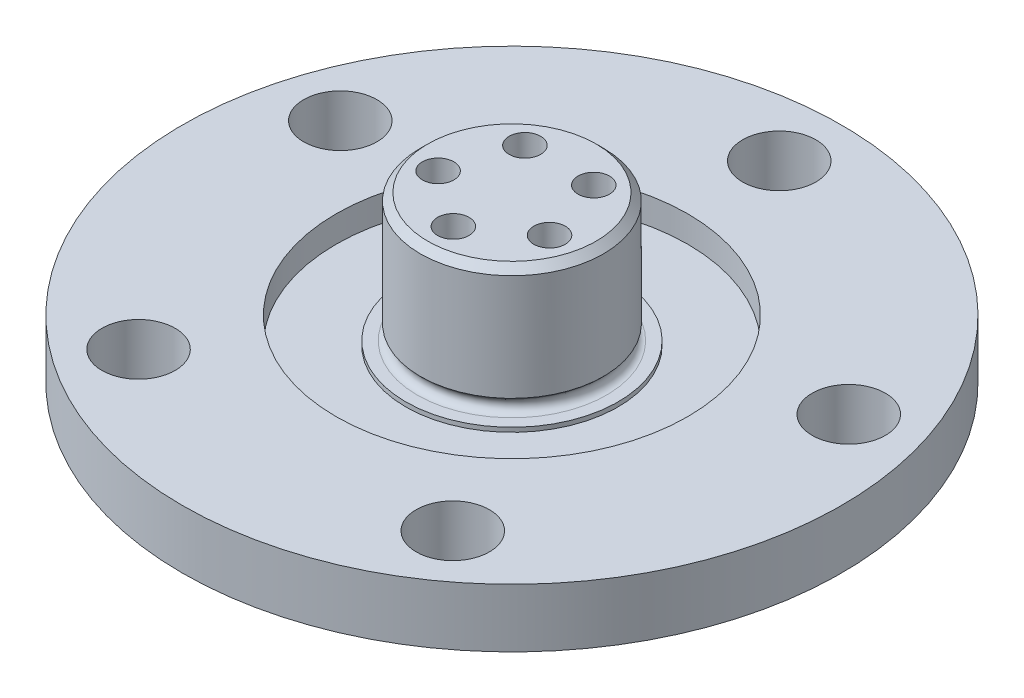
from build123d import *

# Parameters (mm, degrees)
SKETCH1_R                  = 45
SKETCH1_R_2                = 5
BOSS_EXTRUDE1_DEPTH        = 8
F_4_3_4_3_DIAMETER_HOLE1_D = 4.3
SKETCH6_R                  = 30.1
SKETCH6_R_2                = 19.9
CUT_EXTRUDE2_DEPTH         = 1.5
SKETCH8_R                  = 24
SKETCH8_R_2                = 12.5
CUT_EXTRUDE3_DEPTH         = 3
SKETCH9_R                  = 24
SKETCH9_R_2                = 14.5
CUT_EXTRUDE4_DEPTH         = 0.6
SKETCH10_R                 = 12.5
SKETCH10_R_2               = 2.15
BOSS_EXTRUDE2_DEPTH        = 14.5
CHAMFER1_SIZE              = 1
FILLET1_R                  = 1


with BuildPart() as part:
    # Sketch1 → Boss-Extrude1 (new body)
    with BuildSketch(Plane(origin=(0, 0, 0), x_dir=(1, 0, 0), z_dir=(0, 1, 0))):
        with Locations(Location((0, 0, 0), (0, 0, 270))):
            Circle(SKETCH1_R)
        with Locations(Location((0, 36.5, 0), (0, 0, 270))):
            Circle(SKETCH1_R_2, mode=Mode.SUBTRACT)
        with Locations(Location((34.713562845, 11.279120295, 0), (0, 0, 270))):
            Circle(SKETCH1_R_2, mode=Mode.SUBTRACT)
        with Locations(Location((21.454161709, -29.529120295, 0), (0, 0, 270))):
            Circle(SKETCH1_R_2, mode=Mode.SUBTRACT)
        with Locations(Location((-21.454161709, -29.529120295, 0), (0, 0, 270))):
            Circle(SKETCH1_R_2, mode=Mode.SUBTRACT)
        with Locations(Location((-34.713562845, 11.279120295, 0), (0, 0, 270))):
            Circle(SKETCH1_R_2, mode=Mode.SUBTRACT)
    extrude(amount=BOSS_EXTRUDE1_DEPTH)

    # Ø4.3 (4.3) Diameter Hole1 (through all)
    with Locations(Plane(origin=(0, 8, 0), x_dir=(1, 0, 0), z_dir=(0, 1, 0))):
        with Locations((-7.60845213, -2.472135955), (-4.702282018, 6.472135955), (4.702282018, 6.472135955), (7.60845213, -2.472135955), (0, -8)):
            Hole(F_4_3_4_3_DIAMETER_HOLE1_D / 2)

    # Sketch6 → Cut-Extrude2 (cut)
    with BuildSketch(Plane.XZ):
        with Locations(Location((0, 0, 0), (0, 0, 270))):
            Circle(SKETCH6_R)
        with Locations(Location((0, 0, 0), (0, 0, 270))):
            Circle(SKETCH6_R_2, mode=Mode.SUBTRACT)
    extrude(amount=-CUT_EXTRUDE2_DEPTH, mode=Mode.SUBTRACT)

    # Sketch8 → Cut-Extrude3 (cut)
    with BuildSketch(Plane(origin=(0, 8, 0), x_dir=(1, 0, 0), z_dir=(0, 1, 0))):
        with Locations(Location((0, 0, 0), (0, 0, 270))):
            Circle(SKETCH8_R)
        with Locations(Location((0, 0, 0), (0, 0, 270))):
            Circle(SKETCH8_R_2, mode=Mode.SUBTRACT)
    extrude(amount=-CUT_EXTRUDE3_DEPTH, mode=Mode.SUBTRACT)

    # Sketch9 → Cut-Extrude4 (cut)
    with BuildSketch(Plane(origin=(0, 5, 0), x_dir=(1, 0, 0), z_dir=(0, 1, 0))):
        with Locations(Location((0, 0, 0), (0, 0, 270))):
            Circle(SKETCH9_R)
        with Locations(Location((0, 0, 0), (0, 0, 270))):
            Circle(SKETCH9_R_2, mode=Mode.SUBTRACT)
    extrude(amount=-CUT_EXTRUDE4_DEPTH, mode=Mode.SUBTRACT)

    # Sketch10 → Boss-Extrude2 (add)
    with BuildSketch(Plane.XZ.offset(-8)):
        with Locations(Location((0, 0, 0), (0, 0, 90))):
            Circle(SKETCH10_R)
        with Locations(Location((7.60845213, 2.472135955, 0), (0, 0, 90))):
            Circle(SKETCH10_R_2, mode=Mode.SUBTRACT)
        with Locations(Location((4.702282018, -6.472135955, 0), (0, 0, 90))):
            Circle(SKETCH10_R_2, mode=Mode.SUBTRACT)
        with Locations(Location((-4.702282018, -6.472135955, 0), (0, 0, 90))):
            Circle(SKETCH10_R_2, mode=Mode.SUBTRACT)
        with Locations(Location((-7.60845213, 2.472135955, 0), (0, 0, 90))):
            Circle(SKETCH10_R_2, mode=Mode.SUBTRACT)
        with Locations(Location((0, 8, 0), (0, 0, 90))):
            Circle(SKETCH10_R_2, mode=Mode.SUBTRACT)
    extrude(amount=-BOSS_EXTRUDE2_DEPTH)

    # Chamfer1
    chamfer1_edges = [part.edges().sort_by_distance(p)[0] for p in [
        (0, 22.5, -12.5),
    ]]
    chamfer(chamfer1_edges, length=CHAMFER1_SIZE)

    # Sketch11 → Cut-Revolve1 (revolve, cut)
    with BuildSketch(Plane.XY, mode=Mode.PRIVATE) as cut_revolve1_sk:
        Polygon((12.5, 5), (12.5, 7), (10.5, 5), align=None)
    revolve(cut_revolve1_sk.sketch.rotate(Axis((0, 1.5, 0), (0, -1, 0)), 90), axis=Axis((0, 1.5, 0), (0, -1, 0)), mode=Mode.SUBTRACT)

    # Fillet1
    fillet1_edges = [part.edges().sort_by_distance(p)[0] for p in [
        (0, 5, -10.5),
    ]]
    fillet(fillet1_edges, radius=FILLET1_R)


solid = part.part
